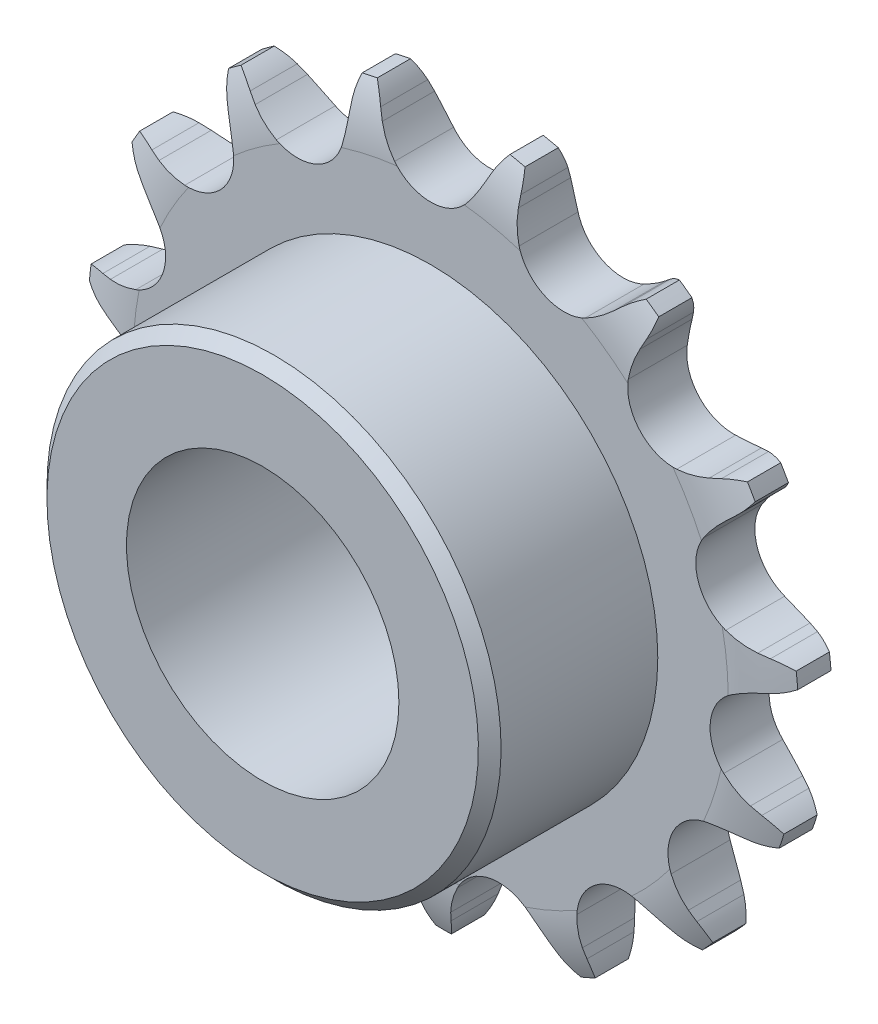
from build123d import *

# Parameters (mm, degrees)
CUT_EXTRUDE1_DEPTH      = 23.54315441
CIRPATTERN1_COUNT       = 15
BOSS_EXTRUDE1_START     = 1.3
SKETCH2_R               = 10
BOSS_EXTRUDE1_DEPTH     = 7.4
CUT_EXTRUDE2_DEPTH      = 25.083300715
CUT_EXTRUDE2_DEPTH_BACK = 25.083300715
SKETCH3_R               = 3
SKETCH4_W               = 1.95
SKETCH4_H               = 5.584687294
CUT_EXTRUDE3_DEPTH      = 25.083300715
CUT_EXTRUDE3_DEPTH_BACK = 25.083300715
SKETCH5_OUTSIDE_W       = 42.85
SKETCH5_OUTSIDE_H       = 42.678
SKETCH5_OUTSIDE_R       = 15.65
CUT_EXTRUDE4_DEPTH      = 24.74557098
CUT_EXTRUDE4_DEPTH_BACK = 24.74557098
SKETCH6_R               = 6


with BuildPart() as part:
    # Sketch1 → Revolve1 (revolve)
    with BuildSketch(Plane(origin=(0, 0, 0), x_dir=(0, 0, -1), z_dir=(1, 0, 0))):
        with BuildLine():
            Line((1.3, 0), (-1.3, 0))
            Line((-1.3, 0), (-1.3, 13.101418106))
            ThreePointArc((-1.3, 13.101418106), (-1.122370651, 14.550555781), (-0.6, 15.913890328))
            Line((-0.6, 15.913890328), (0.6, 15.913890328))
            ThreePointArc((0.6, 15.913890328), (1.122370651, 14.550555781), (1.3, 13.101418106))
            Line((1.3, 13.101418106), (1.3, 0))
        make_face()
    revolve(axis=Axis((0, 0, -1.3), (0, 0, 1)))

    # Sketch0 → Cut-Extrude1 (cut, symmetric)
    with BuildSketch(Plane.XY):
        with BuildLine():
            Line((5.458731892, -13.819129077), (5.192148114, -13.461913404))
            ThreePointArc((5.192148114, -13.461913404), (4.769815507, -12.963915887), (4.288911093, -12.522217685))
            ThreePointArc((4.288911093, -12.522217685), (2.574176066, -12.110546227), (1.175129538, -13.184072386))
            ThreePointArc((1.175129538, -13.184072386), (0.915456339, -13.78318522), (0.732190143, -14.409906736))
            Line((0.732190143, -14.409906736), (0.633946447, -14.844668882))
            ThreePointArc((0.633946447, -14.844668882), (-0.774190712, -16.881356201), (-3.200657759, -17.374512534))
            ThreePointArc((-3.200657759, -17.374512534), (3.673146461, -17.280795438), (9.99079726, -14.570582212))
            ThreePointArc((9.99079726, -14.570582212), (7.573524561, -15.106994545), (5.458731892, -13.819129077))
        make_face()
    cut_extrude1 = extrude(amount=CUT_EXTRUDE1_DEPTH, both=True, mode=Mode.SUBTRACT)

    # CirPattern1: Cut-Extrude1 ×15 about axis
    cirpattern1_axis = Axis((0, 0, 0), (0, 0, 1))
    for i in range(1, CIRPATTERN1_COUNT):
        add(cut_extrude1.rotate(cirpattern1_axis, i * 360 / CIRPATTERN1_COUNT), mode=Mode.SUBTRACT)

    # Sketch2 → Boss-Extrude1 (add)
    with BuildSketch(Plane.XY.offset(BOSS_EXTRUDE1_START)):
        with Locations(Location((0, 0, 0), (0, 0, 270))):
            Circle(SKETCH2_R)
    extrude(amount=BOSS_EXTRUDE1_DEPTH)

    # Sketch3 → Cut-Extrude2 (cut, two sides: drawn at the far end of the back side and taken through both)
    with BuildSketch(Plane.XY.offset(-CUT_EXTRUDE2_DEPTH_BACK)):
        Circle(SKETCH3_R)
    extrude(amount=CUT_EXTRUDE2_DEPTH + CUT_EXTRUDE2_DEPTH_BACK, mode=Mode.SUBTRACT)

    # Sketch4 → Cut-Revolve1 (revolve, cut)
    with BuildSketch(Plane(origin=(0, 0, 0), x_dir=(0, 0, -1), z_dir=(1, 0, 0))):
        Polygon((-8.7, 10), (-8.7, 9.5), (-8.2, 10), align=None)
        with Locations((-2.275, 13.121546681)):
            Rectangle(SKETCH4_W, SKETCH4_H)
    revolve(axis=Axis((0, 0, -1.3), (0, 0, 1)), mode=Mode.SUBTRACT)

    # Sketch5 outside → Cut-Extrude3 (cut, two sides: drawn at the far end of the back side and taken through both)
    with BuildSketch(Plane.XY.offset(-CUT_EXTRUDE3_DEPTH_BACK)):
        with Locations((0, -0.155)):
            Rectangle(SKETCH5_OUTSIDE_W, SKETCH5_OUTSIDE_H)
        Circle(SKETCH5_OUTSIDE_R, mode=Mode.SUBTRACT)
    extrude(amount=CUT_EXTRUDE3_DEPTH + CUT_EXTRUDE3_DEPTH_BACK, mode=Mode.SUBTRACT)

    # Sketch6 → Cut-Extrude4 (cut, two sides: drawn at the far end of the back side and taken through both)
    with BuildSketch(Plane.XY.offset(-CUT_EXTRUDE4_DEPTH_BACK)):
        with Locations(Location((0, 0, 0), (0, 0, 90))):
            Circle(SKETCH6_R)
    extrude(amount=CUT_EXTRUDE4_DEPTH + CUT_EXTRUDE4_DEPTH_BACK, mode=Mode.SUBTRACT)


solid = part.part
